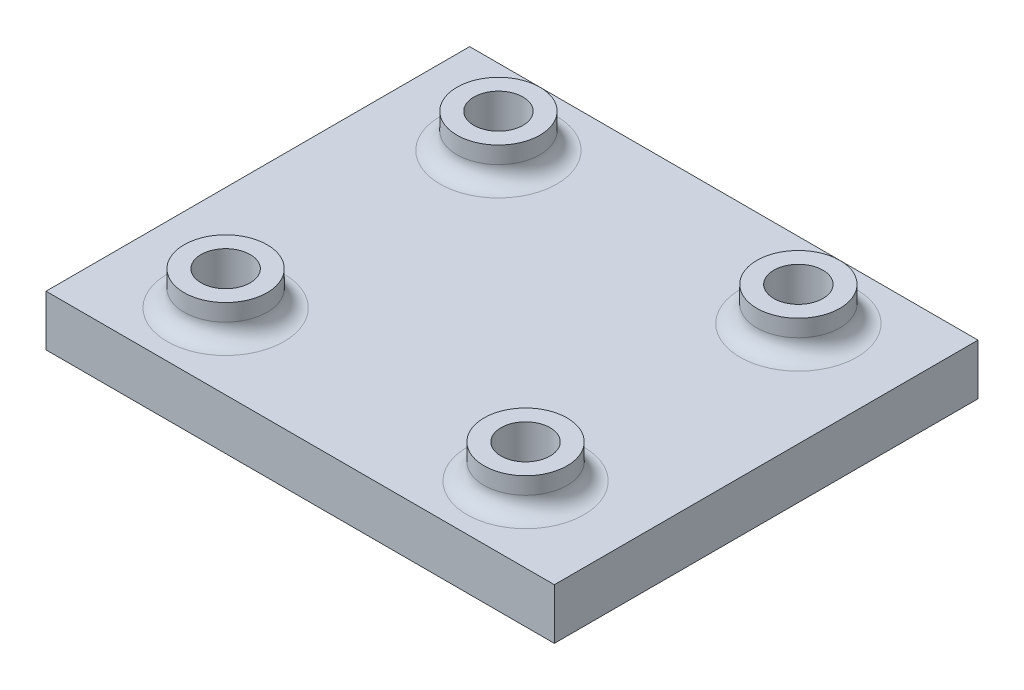
from build123d import *

# Parameters (mm, degrees)
SKETCH1_W           = 30
SKETCH1_H           = 25
SKETCH1_R           = 1.45
BOSS_EXTRUDE1_DEPTH = 3
SKETCH2_R           = 2.45
SKETCH2_R_2         = 1.45
BOSS_EXTRUDE2_DEPTH = 2
CUT_EXTRUDE1_DEPTH  = 2
FILLET1_R           = 1


with BuildPart() as part:
    # Sketch1 → Boss-Extrude1 (new body)
    with BuildSketch(Plane(origin=(0, 0, 0), x_dir=(1, 0, 0), z_dir=(0, 1, 0))):
        with Locations((15, 12.5)):
            Rectangle(SKETCH1_W, SKETCH1_H)
        with Locations(Location((6.15, 20.55, 0), (0, 0, 270))):
            Circle(SKETCH1_R, mode=Mode.SUBTRACT)
        with Locations(Location((23.85, 20.55, 0), (0, 0, 270))):
            Circle(SKETCH1_R, mode=Mode.SUBTRACT)
        with Locations(Location((6.15, 4.45, 0), (0, 0, 270))):
            Circle(SKETCH1_R, mode=Mode.SUBTRACT)
        with Locations(Location((23.85, 4.45, 0), (0, 0, 270))):
            Circle(SKETCH1_R, mode=Mode.SUBTRACT)
    extrude(amount=BOSS_EXTRUDE1_DEPTH)

    # Sketch2 → Boss-Extrude2 (add)
    # profile 1 of 4: a face of its own
    with BuildSketch(Plane(origin=(0, 3, 0), x_dir=(1, 0, 0), z_dir=(0, 1, 0))):
        with Locations(Location((6.15, 20.55, 0), (0, 0, 90))):
            Circle(SKETCH2_R)
        with Locations(Location((6.15, 20.55, 0), (0, 0, 270))):
            Circle(SKETCH2_R_2, mode=Mode.SUBTRACT)
    # profile 2 of 4: a face of its own
    with BuildSketch(Plane(origin=(0, 3, 0), x_dir=(1, 0, 0), z_dir=(0, 1, 0))):
        with Locations(Location((23.85, 20.55, 0), (0, 0, 90))):
            Circle(SKETCH2_R)
        with Locations(Location((23.85, 20.55, 0), (0, 0, 270))):
            Circle(SKETCH2_R_2, mode=Mode.SUBTRACT)
    # profile 3 of 4: a face of its own
    with BuildSketch(Plane(origin=(0, 3, 0), x_dir=(1, 0, 0), z_dir=(0, 1, 0))):
        with Locations(Location((6.15, 4.45, 0), (0, 0, 90))):
            Circle(SKETCH2_R)
        with Locations(Location((6.15, 4.45, 0), (0, 0, 270))):
            Circle(SKETCH2_R_2, mode=Mode.SUBTRACT)
    # profile 4 of 4: a face of its own
    with BuildSketch(Plane(origin=(0, 3, 0), x_dir=(1, 0, 0), z_dir=(0, 1, 0))):
        with Locations(Location((23.85, 4.45, 0), (0, 0, 90))):
            Circle(SKETCH2_R)
        with Locations(Location((23.85, 4.45, 0), (0, 0, 270))):
            Circle(SKETCH2_R_2, mode=Mode.SUBTRACT)
    extrude(amount=BOSS_EXTRUDE2_DEPTH)

    # Sketch3 → Cut-Extrude1 (cut)
    with BuildSketch(Plane.XZ):
        Polygon((7.679978213, -7.1), (9.209956427, -4.45), (7.679978213, -1.8), (4.620021787, -1.8), (3.090043573, -4.45), (4.620021787, -7.1), align=None)
        Polygon((25.379978213, -7.1), (26.909956427, -4.45), (25.379978213, -1.8), (22.320021787, -1.8), (20.790043573, -4.45), (22.320021787, -7.1), align=None)
        Polygon((25.379978213, -23.2), (26.909956427, -20.55), (25.379978213, -17.9), (22.320021787, -17.9), (20.790043573, -20.55), (22.320021787, -23.2), align=None)
        Polygon((7.679978213, -23.2), (9.209956427, -20.55), (7.679978213, -17.9), (4.620021787, -17.9), (3.090043573, -20.55), (4.620021787, -23.2), align=None)
    extrude(amount=-CUT_EXTRUDE1_DEPTH, mode=Mode.SUBTRACT)

    # Fillet1
    fillet1_edges = [part.edges().sort_by_distance(p)[0] for p in [
        (6.15, 3, -18.1),
        (23.85, 3, -18.1),
        (6.15, 3, -2),
        (23.85, 3, -2),
    ]]
    fillet(fillet1_edges, radius=FILLET1_R)


solid = part.part
